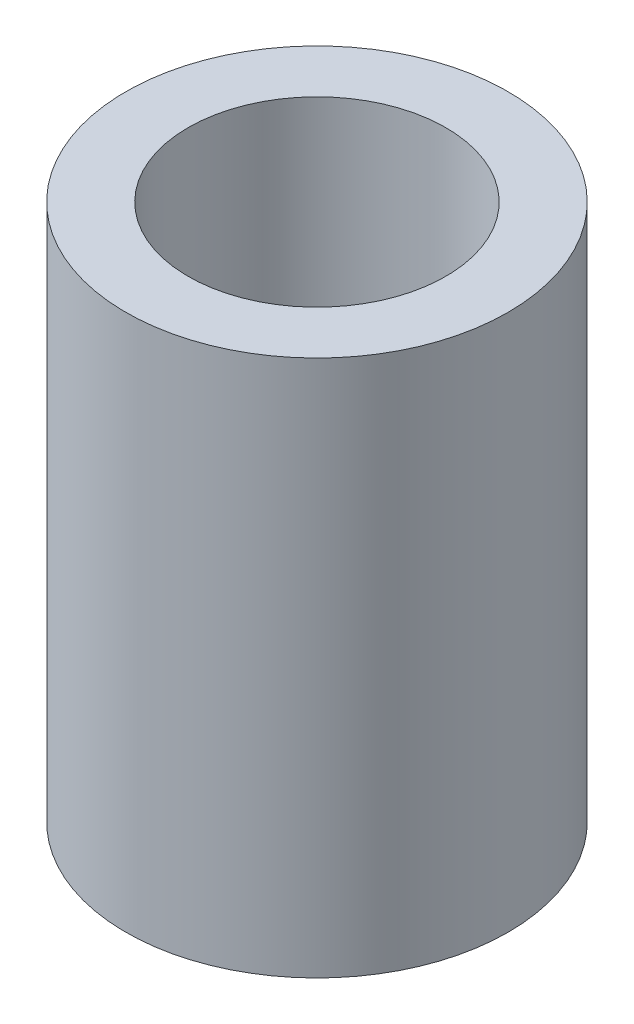
from build123d import *

# Parameters (mm, degrees)
CROQUIS1_W            = 8.9
CROQUIS1_H            = 25
CROQUIS2_R            = 6
CORTAR_EXTRUIR1_DEPTH = 17
CROQUIS3_R            = 3
CORTAR_EXTRUIR2_DEPTH = 12.5


with BuildPart() as part:
    # Croquis1 → Revolución1 (revolve)
    with BuildSketch(Plane.XY):
        with Locations((4.45, 12.5)):
            Rectangle(CROQUIS1_W, CROQUIS1_H)
    revolve(axis=Axis((0, 0, 0), (0, 1, 0)))

    # Croquis2 → Cortar-Extruir1 (cut)
    with BuildSketch(Plane(origin=(0, 25, 0), x_dir=(1, 0, 0), z_dir=(0, 1, 0))):
        with Locations(Location((0, 0, 0), (0, 0, 180))):
            Circle(CROQUIS2_R)
    extrude(amount=-CORTAR_EXTRUIR1_DEPTH, mode=Mode.SUBTRACT)

    # Croquis3 → Cortar-Extruir2 (cut)
    with BuildSketch(Plane.XZ):
        Circle(CROQUIS3_R)
    extrude(amount=-CORTAR_EXTRUIR2_DEPTH, mode=Mode.SUBTRACT)


solid = part.part
